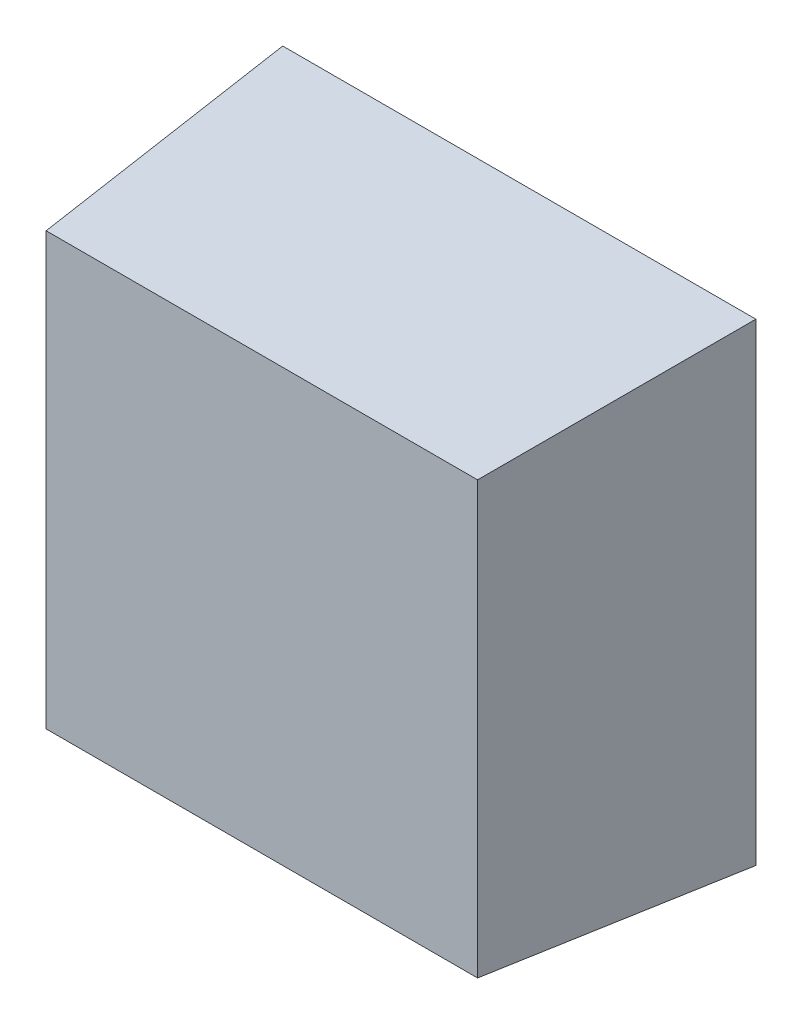
from build123d import *

# Parameters (mm, degrees)
SKETCH1_W           = 40
SKETCH1_H           = 40
BOSS_EXTRUDE1_DEPTH = 20
DRAFT1_ANGLE        = -10


with BuildPart() as part:
    # Sketch1 → Boss-Extrude1 (new body)
    with BuildSketch(Plane.XY):
        with Locations((20, 20)):
            Rectangle(SKETCH1_W, SKETCH1_H)
    extrude(amount=BOSS_EXTRUDE1_DEPTH)

    # Draft1
    draft1_faces = [part.faces().sort_by_distance(p)[0] for p in [
        (20, 40, 10),
        (40, 20, 10),
    ]]
    draft(draft1_faces, Plane(origin=(0, 0, 0), x_dir=(-1, 0, 0), z_dir=(0, 0, -1)), DRAFT1_ANGLE)


solid = part.part
